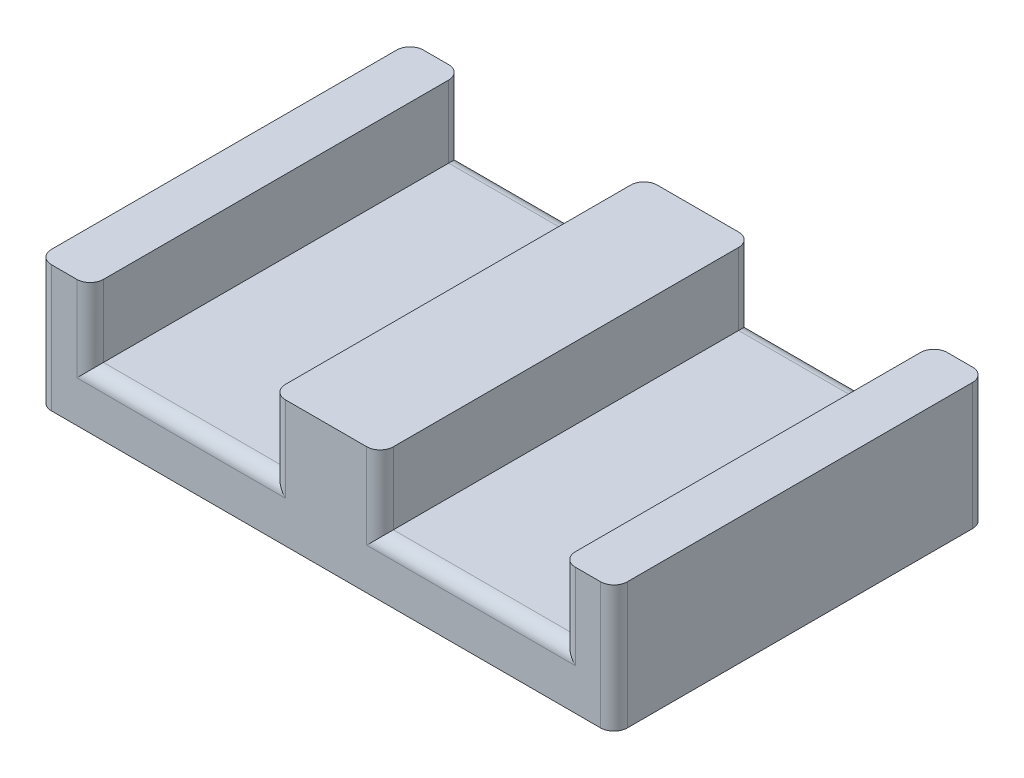
from build123d import *

# Parameters (mm, degrees)
SKETCH_1_W      = 43.2
SKETCH_1_H      = 27.9
EXTRUDE_1_DEPTH = 4.1
SKETCH_2_W      = 8.1
SKETCH_2_H      = 27.9
SKETCH_2_W_2    = 3.9
EXTRUDE_2_DEPTH = 5.4
FILLET_1_R      = 1


with BuildPart() as part:
    # Эскиз1 → Бобышка-Вытянуть1 (new body)
    with BuildSketch(Plane(origin=(0, 0, 0), x_dir=(1, 0, 0), z_dir=(0, 1, 0))):
        Rectangle(SKETCH_1_W, SKETCH_1_H)
    extrude(amount=EXTRUDE_1_DEPTH)

    # Эскиз2 → Бобышка-Вытянуть2 (add)
    with BuildSketch(Plane(origin=(0, 4.1, 0), x_dir=(1, 0, 0), z_dir=(0, 1, 0))):
        Rectangle(SKETCH_2_W, SKETCH_2_H)
        with Locations((-19.65, 0)):
            Rectangle(SKETCH_2_W_2, SKETCH_2_H)
        with Locations((19.65, 0)):
            Rectangle(SKETCH_2_W_2, SKETCH_2_H)
    extrude(amount=EXTRUDE_2_DEPTH)

    # Скругление1
    fillet_1_edges = [part.edges().sort_by_distance(p)[0] for p in [
        (-10.875, 4.1, -13.95),
        (10.875, 4.1, 13.95),
        (4.05, 6.8, 13.95),
        (4.05, 6.8, -13.95),
        (-4.05, 6.8, -13.95),
        (-4.05, 6.8, 13.95),
        (-10.875, 4.1, 13.95),
        (-17.7, 6.8, 13.95),
        (-17.7, 6.8, -13.95),
        (10.875, 4.1, -13.95),
        (17.7, 6.8, -13.95),
        (17.7, 6.8, 13.95),
        (21.6, 4.75, 13.95),
        (-21.6, 4.75, 13.95),
        (-21.6, 4.75, -13.95),
        (21.6, 4.75, -13.95),
    ]]
    fillet(fillet_1_edges, radius=FILLET_1_R)


solid = part.part
